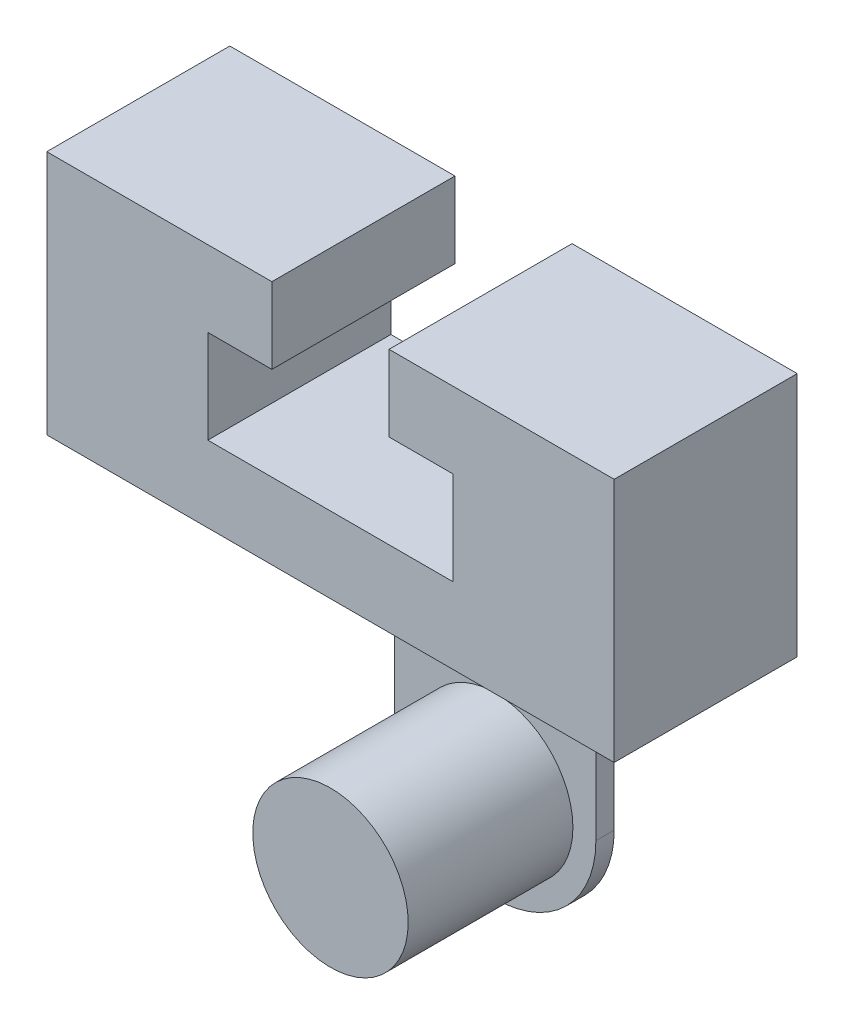
from build123d import *

# Parameters (mm, degrees)
BOSS_EXTRUDE3_DEPTH = 25.4
CUT_EXTRUDE2_DEPTH  = 96.400249497
CUT_EXTRUDE3_START  = -22.86
CUT_EXTRUDE3_DEPTH  = 22.86
SKETCH8_R           = 10.7823
BOSS_EXTRUDE4_DEPTH = 22.86


with BuildPart() as part:
    # Sketch4 → Boss-Extrude3 (new body)
    with BuildSketch(Plane.XY):
        with BuildLine():
            Line((0, 0), (25.4, 0))
            Line((25.4, 0), (25.4, -33.528))
            ThreePointArc((25.4, -33.528), (39.37, -47.498), (53.34, -33.528))
            Line((53.34, -33.528), (53.34, 0))
            Line((53.34, 0), (78.74, 0))
            Line((78.74, 0), (78.74, 34.036))
            Line((78.74, 34.036), (0, 34.036))
            Line((0, 34.036), (0, 0))
        make_face()
    extrude(amount=BOSS_EXTRUDE3_DEPTH)

    # Sketch5 → Cut-Extrude2 (cut, through all)
    with BuildSketch(Plane.XY.offset(25.4)):
        Polygon((47.498, 23.495), (56.388, 23.495), (56.388, 10.541), (22.352, 10.541), (22.352, 23.495), (31.242, 23.495), (31.242, 34.036), (47.498, 34.036), align=None)
    extrude(amount=-CUT_EXTRUDE2_DEPTH, mode=Mode.SUBTRACT)

    # Sketch7 → Cut-Extrude3 (cut)
    with BuildSketch(Plane.XY.offset(25.4).offset(CUT_EXTRUDE3_START)):
        with BuildLine():
            Line((25.4, 0), (53.34, 0))
            Line((53.34, 0), (53.34, -33.528))
            ThreePointArc((53.34, -33.528), (39.37, -47.498), (25.4, -33.528))
            Line((25.4, -33.528), (25.4, 0))
        make_face()
    extrude(amount=CUT_EXTRUDE3_DEPTH, mode=Mode.SUBTRACT)

    # Sketch8 → Boss-Extrude4 (add)
    with BuildSketch(Plane.XY.offset(2.54)):
        with Locations((39.37, -33.528)):
            Circle(SKETCH8_R)
    extrude(amount=BOSS_EXTRUDE4_DEPTH)


solid = part.part
